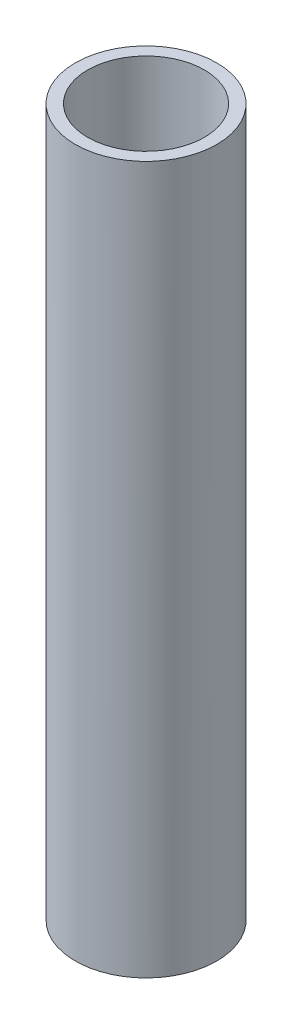
from build123d import *

# Parameters (mm, degrees)
SKETCH1_R           = 14.605
SKETCH1_R_2         = 12.065
BOSS_EXTRUDE1_DEPTH = 146.05
SKETCH2_W           = 3.556
SKETCH2_H           = 25.4
CUT_EXTRUDE1_DEPTH  = 25.4


with BuildPart() as part:
    # Sketch1 → Boss-Extrude1 (new body)
    with BuildSketch(Plane(origin=(0, 0, 0), x_dir=(1, 0, 0), z_dir=(0, 1, 0))):
        with Locations(Location((0, 0, 0), (0, 0, 270))):
            Circle(SKETCH1_R)
        with Locations(Location((0, 0, 0), (0, 0, 270))):
            Circle(SKETCH1_R_2, mode=Mode.SUBTRACT)
    extrude(amount=BOSS_EXTRUDE1_DEPTH)

    # Sketch2 → Cut-Extrude1 (cut)
    with BuildSketch(Plane.XY):
        with Locations((0, 12.7)):
            Rectangle(SKETCH2_W, SKETCH2_H)
    extrude(amount=-CUT_EXTRUDE1_DEPTH, mode=Mode.SUBTRACT)


solid = part.part
